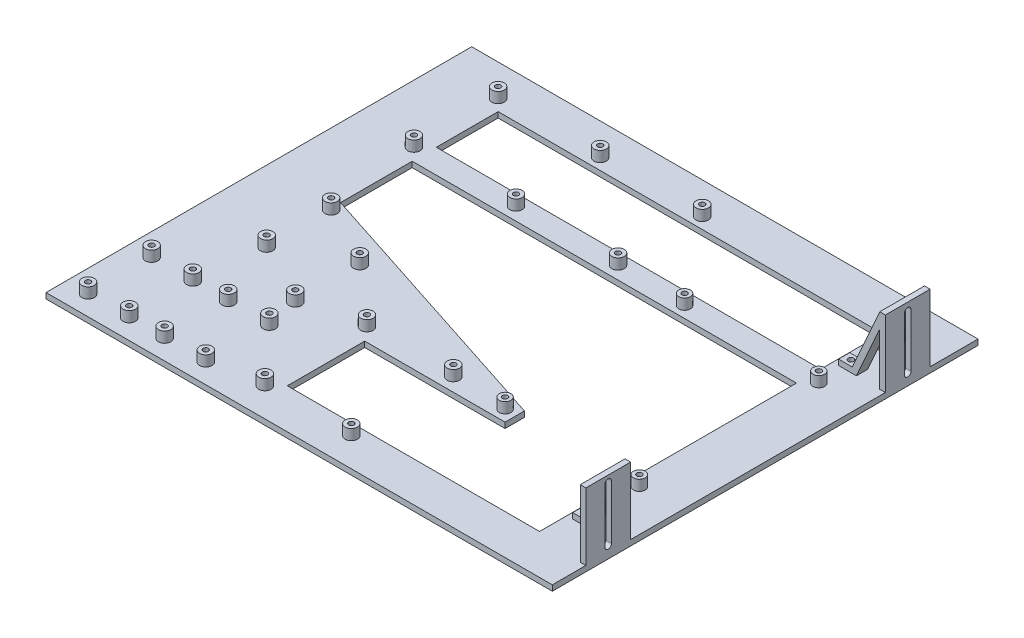
from build123d import *

# Parameters (mm, degrees)
SKETCH1_W            = 287.274
SKETCH1_H            = 241.554
BOSS_EXTRUDE1_DEPTH  = 3.175
SKETCH2_W            = 3.175
SKETCH2_H            = 25.4
BOSS_EXTRUDE3_DEPTH  = 38.1
CUT_EXTRUDE1_DEPTH   = 25.4
SKETCH4_R            = 3.302
SKETCH4_R_2          = 1.5
BOSS_EXTRUDE4_DEPTH  = 6
SKETCH5_R            = 3.5
SKETCH5_R_2          = 1.5
BOSS_EXTRUDE5_DEPTH  = 6
SKETCH6_R            = 3.5
SKETCH6_R_2          = 1.5
BOSS_EXTRUDE6_DEPTH  = 6
SKETCH7_R            = 3.5
SKETCH7_R_2          = 1.5
BOSS_EXTRUDE7_DEPTH  = 6
SKETCH8_R            = 3.5
SKETCH8_R_2          = 1.5
BOSS_EXTRUDE8_DEPTH  = 6
SKETCH9_W            = 3.175
SKETCH9_H            = 25.4
BOSS_EXTRUDE9_DEPTH  = 38.1
CUT_EXTRUDE3_DEPTH   = 38.1
BOSS_EXTRUDE11_DEPTH = 6.35
BOSS_EXTRUDE12_DEPTH = 6.35
BOSS_EXTRUDE13_DEPTH = 6.35
SKETCH25_W           = 3.771984775
SKETCH25_H           = 6.35
BOSS_EXTRUDE14_DEPTH = 3.175
SKETCH26_W           = 6.35
SKETCH26_H           = 3.175
BOSS_EXTRUDE15_DEPTH = 6.35
SKETCH27_R           = 1.5875
CUT_EXTRUDE7_DEPTH   = 3.175
SKETCH28_W           = 3.771984775
SKETCH28_H           = 6.35
BOSS_EXTRUDE16_DEPTH = 3.175
SKETCH29_W           = 6.35
SKETCH29_H           = 3.175
BOSS_EXTRUDE17_DEPTH = 6.35
SKETCH30_R           = 1.5875
CUT_EXTRUDE8_DEPTH   = 3.175
SKETCH31_W           = 3.771984775
SKETCH31_H           = 6.35
BOSS_EXTRUDE18_DEPTH = 3.175
SKETCH32_W           = 6.35
SKETCH32_H           = 3.175
BOSS_EXTRUDE19_DEPTH = 6.35
SKETCH33_R           = 1.5875
CUT_EXTRUDE9_DEPTH   = 3.175
SKETCH34_W           = 218.059
SKETCH34_H           = 35.052
CUT_EXTRUDE10_DEPTH  = 192.494860239


with BuildPart() as part:
    # Sketch1 → Boss-Extrude1 (new body)
    with BuildSketch(Plane(origin=(0, 0, 0), x_dir=(1, 0, 0), z_dir=(0, 1, 0))):
        Rectangle(SKETCH1_W, SKETCH1_H)
    extrude(amount=BOSS_EXTRUDE1_DEPTH)

    # Sketch2 → Boss-Extrude3 (add)
    with BuildSketch(Plane(origin=(0, 3.175, 0), x_dir=(1, 0, 0), z_dir=(0, 1, 0))):
        with Locations((142.0495, 80.899)):
            Rectangle(SKETCH2_W, SKETCH2_H)
    extrude(amount=BOSS_EXTRUDE3_DEPTH)

    # Sketch3 → Cut-Extrude1 (cut)
    with BuildSketch(Plane.ZY.offset(-140.462)):
        with BuildLine():
            Line((-78.994, 36.656885263), (-78.994, 6.383215744))
            ThreePointArc((-78.994, 6.383215744), (-80.899, 4.478215744), (-82.804, 6.383215744))
            Line((-82.804, 6.383215744), (-82.804, 36.656885263))
            ThreePointArc((-82.804, 36.656885263), (-80.899, 38.561885263), (-78.994, 36.656885263))
        make_face()
    extrude(amount=-CUT_EXTRUDE1_DEPTH, mode=Mode.SUBTRACT)

    # Sketch4 → Boss-Extrude4 (add)
    # profile 1 of 4: a face of its own
    with BuildSketch(Plane(origin=(0, 3.175, 0), x_dir=(1, 0, 0), z_dir=(0, 1, 0))):
        with Locations(Location((43.942, 53.975, 0), (0, 0, 270))):
            Circle(SKETCH4_R)
        with Locations(Location((43.942, 53.975, 0), (0, 0, 90))):
            Circle(SKETCH4_R_2, mode=Mode.SUBTRACT)
    # profile 2 of 4: a face of its own
    with BuildSketch(Plane(origin=(0, 3.175, 0), x_dir=(1, 0, 0), z_dir=(0, 1, 0))):
        with Locations(Location((120.142, 53.975, 0), (0, 0, 90))):
            Circle(SKETCH4_R)
        with Locations(Location((120.142, 53.975, 0), (0, 0, 270))):
            Circle(SKETCH4_R_2, mode=Mode.SUBTRACT)
    # profile 3 of 4: a face of its own
    with BuildSketch(Plane(origin=(0, 3.175, 0), x_dir=(1, 0, 0), z_dir=(0, 1, 0))):
        with Locations(Location((43.942, -47.879, 0), (0, 0, 90))):
            Circle(SKETCH4_R)
        with Locations(Location((43.942, -47.879, 0), (0, 0, 270))):
            Circle(SKETCH4_R_2, mode=Mode.SUBTRACT)
    # profile 4 of 4: a face of its own
    with BuildSketch(Plane(origin=(0, 3.175, 0), x_dir=(1, 0, 0), z_dir=(0, 1, 0))):
        with Locations(Location((120.142, -47.879, 0), (0, 0, 270))):
            Circle(SKETCH4_R)
        with Locations(Location((120.142, -47.879, 0), (0, 0, 90))):
            Circle(SKETCH4_R_2, mode=Mode.SUBTRACT)
    extrude(amount=BOSS_EXTRUDE4_DEPTH)

    # Sketch5 → Boss-Extrude5 (add)
    # profile 1 of 9: a face of its own
    with BuildSketch(Plane(origin=(0, 3.175, 0), x_dir=(1, 0, 0), z_dir=(0, 1, 0))):
        with Locations(Location((-110.617, 102.743, 0), (0, 0, 90))):
            Circle(SKETCH5_R)
        with Locations(Location((-110.617, 102.743, 0), (0, 0, 270))):
            Circle(SKETCH5_R_2, mode=Mode.SUBTRACT)
    # profile 2 of 9: a face of its own
    with BuildSketch(Plane(origin=(0, 3.175, 0), x_dir=(1, 0, 0), z_dir=(0, 1, 0))):
        with Locations(Location((-52.705, 102.743, 0), (0, 0, 90))):
            Circle(SKETCH5_R)
        with Locations(Location((-52.705, 102.743, 0), (0, 0, 270))):
            Circle(SKETCH5_R_2, mode=Mode.SUBTRACT)
    # profile 3 of 9: a face of its own
    with BuildSketch(Plane(origin=(0, 3.175, 0), x_dir=(1, 0, 0), z_dir=(0, 1, 0))):
        with BuildLine():
            ThreePointArc((8.707, 102.743), (8.686399881, 103.122178676), (8.624842018, 103.496893852))
            Line((8.624842018, 103.496893852), (6.503782194, 103.496893852))
            ThreePointArc((6.503782194, 103.496893852), (6.655304749, 103.13340153), (6.707, 102.743))
            ThreePointArc((6.707, 102.743), (4.146339828, 101.682339828), (5.207, 104.243))
            Line((5.207, 104.243), (5.207, 106.243))
            ThreePointArc((5.207, 106.243), (2.732126266, 100.268126266), (8.707, 102.743))
        make_face()
    # profile 4 of 9: a face of its own
    with BuildSketch(Plane(origin=(0, 3.175, 0), x_dir=(1, 0, 0), z_dir=(0, 1, 0))):
        with BuildLine():
            Line((6.503782194, 103.496893852), (8.624842018, 103.496893852))
            ThreePointArc((8.624842018, 103.496893852), (7.399187437, 105.471427064), (5.207, 106.243))
            Line((5.207, 106.243), (5.207, 104.243))
            ThreePointArc((5.207, 104.243), (5.95505054, 104.043161678), (6.503782194, 103.496893852))
        make_face()
    # profile 5 of 9: a face of its own
    with BuildSketch(Plane(origin=(0, 3.175, 0), x_dir=(1, 0, 0), z_dir=(0, 1, 0))):
        with BuildLine():
            ThreePointArc((8.707, 102.743), (8.686399881, 103.122178676), (8.624842018, 103.496893852))
            Line((8.624842018, 103.496893852), (6.503782194, 103.496893852))
            ThreePointArc((6.503782194, 103.496893852), (6.655304749, 103.13340153), (6.707, 102.743))
            ThreePointArc((6.707, 102.743), (4.146339828, 101.682339828), (5.207, 104.243))
            Line((5.207, 104.243), (5.207, 106.243))
            ThreePointArc((5.207, 106.243), (2.732126266, 100.268126266), (8.707, 102.743))
        make_face()
    # profile 6 of 9: a face of its own
    with BuildSketch(Plane(origin=(0, 3.175, 0), x_dir=(1, 0, 0), z_dir=(0, 1, 0))):
        with BuildLine():
            Line((6.503782194, 103.496893852), (8.624842018, 103.496893852))
            ThreePointArc((8.624842018, 103.496893852), (7.399187437, 105.471427064), (5.207, 106.243))
            Line((5.207, 106.243), (5.207, 104.243))
            ThreePointArc((5.207, 104.243), (5.95505054, 104.043161678), (6.503782194, 103.496893852))
        make_face()
    # profile 7 of 9: a face of its own
    with BuildSketch(Plane(origin=(0, 3.175, 0), x_dir=(1, 0, 0), z_dir=(0, 1, 0))):
        with Locations(Location((-110.617, 54.991, 0), (0, 0, 90))):
            Circle(SKETCH5_R)
        with Locations(Location((-110.617, 54.991, 0), (0, 0, 270))):
            Circle(SKETCH5_R_2, mode=Mode.SUBTRACT)
    # profile 8 of 9: a face of its own
    with BuildSketch(Plane(origin=(0, 3.175, 0), x_dir=(1, 0, 0), z_dir=(0, 1, 0))):
        with Locations(Location((-52.705, 54.991, 0), (0, 0, 90))):
            Circle(SKETCH5_R)
        with Locations(Location((-52.705, 54.991, 0), (0, 0, 270))):
            Circle(SKETCH5_R_2, mode=Mode.SUBTRACT)
    # profile 9 of 9: a face of its own
    with BuildSketch(Plane(origin=(0, 3.175, 0), x_dir=(1, 0, 0), z_dir=(0, 1, 0))):
        with Locations(Location((5.207, 54.991, 0), (0, 0, 90))):
            Circle(SKETCH5_R)
        with Locations(Location((5.207, 54.991, 0), (0, 0, 270))):
            Circle(SKETCH5_R_2, mode=Mode.SUBTRACT)
    extrude(amount=BOSS_EXTRUDE5_DEPTH)

    # Sketch6 → Boss-Extrude6 (add)
    # profile 1 of 8: a face of its own
    with BuildSketch(Plane(origin=(0, 3.175, 0), x_dir=(1, 0, 0), z_dir=(0, 1, 0))):
        with Locations(Location((-130.937, -73.533, 0), (0, 0, 90))):
            Circle(SKETCH6_R)
        with Locations(Location((-130.937, -73.533, 0), (0, 0, 270))):
            Circle(SKETCH6_R_2, mode=Mode.SUBTRACT)
    # profile 2 of 8: a face of its own
    with BuildSketch(Plane(origin=(0, 3.175, 0), x_dir=(1, 0, 0), z_dir=(0, 1, 0))):
        with Locations(Location((-107.569, -73.533, 0), (0, 0, 90))):
            Circle(SKETCH6_R)
        with Locations(Location((-107.569, -73.533, 0), (0, 0, 270))):
            Circle(SKETCH6_R_2, mode=Mode.SUBTRACT)
    # profile 3 of 8: a face of its own
    with BuildSketch(Plane(origin=(0, 3.175, 0), x_dir=(1, 0, 0), z_dir=(0, 1, 0))):
        with Locations(Location((-130.937, -109.601, 0), (0, 0, 90))):
            Circle(SKETCH6_R)
        with Locations(Location((-130.937, -109.601, 0), (0, 0, 270))):
            Circle(SKETCH6_R_2, mode=Mode.SUBTRACT)
    # profile 4 of 8: a face of its own
    with BuildSketch(Plane(origin=(0, 3.175, 0), x_dir=(1, 0, 0), z_dir=(0, 1, 0))):
        with Locations(Location((-107.569, -109.601, 0), (0, 0, 90))):
            Circle(SKETCH6_R)
        with Locations(Location((-107.569, -109.601, 0), (0, 0, 270))):
            Circle(SKETCH6_R_2, mode=Mode.SUBTRACT)
    # profile 5 of 8: a face of its own
    with BuildSketch(Plane(origin=(0, 3.175, 0), x_dir=(1, 0, 0), z_dir=(0, 1, 0))):
        with Locations(Location((-87.503, -73.533, 0), (0, 0, 90))):
            Circle(SKETCH6_R)
        with Locations(Location((-87.503, -73.533, 0), (0, 0, 270))):
            Circle(SKETCH6_R_2, mode=Mode.SUBTRACT)
    # profile 6 of 8: a face of its own
    with BuildSketch(Plane(origin=(0, 3.175, 0), x_dir=(1, 0, 0), z_dir=(0, 1, 0))):
        with Locations(Location((-64.135, -73.533, 0), (0, 0, 90))):
            Circle(SKETCH6_R)
        with Locations(Location((-64.135, -73.533, 0), (0, 0, 270))):
            Circle(SKETCH6_R_2, mode=Mode.SUBTRACT)
    # profile 7 of 8: a face of its own
    with BuildSketch(Plane(origin=(0, 3.175, 0), x_dir=(1, 0, 0), z_dir=(0, 1, 0))):
        with Locations(Location((-87.503, -109.601, 0), (0, 0, 90))):
            Circle(SKETCH6_R)
        with Locations(Location((-87.503, -109.601, 0), (0, 0, 270))):
            Circle(SKETCH6_R_2, mode=Mode.SUBTRACT)
    # profile 8 of 8: a face of its own
    with BuildSketch(Plane(origin=(0, 3.175, 0), x_dir=(1, 0, 0), z_dir=(0, 1, 0))):
        with Locations(Location((-64.135, -109.601, 0), (0, 0, 90))):
            Circle(SKETCH6_R)
        with Locations(Location((-64.135, -109.601, 0), (0, 0, 270))):
            Circle(SKETCH6_R_2, mode=Mode.SUBTRACT)
    extrude(amount=BOSS_EXTRUDE6_DEPTH)

    # Sketch7 → Boss-Extrude7 (add)
    # profile 1 of 4: a face of its own
    with BuildSketch(Plane(origin=(0, 3.175, 0), x_dir=(1, 0, 0), z_dir=(0, 1, 0))):
        with Locations(Location((-103.251, -35.941, 0), (0, 0, 90))):
            Circle(SKETCH7_R)
        with Locations(Location((-103.251, -35.941, 0), (0, 0, 270))):
            Circle(SKETCH7_R_2, mode=Mode.SUBTRACT)
    # profile 2 of 4: a face of its own
    with BuildSketch(Plane(origin=(0, 3.175, 0), x_dir=(1, 0, 0), z_dir=(0, 1, 0))):
        with Locations(Location((-68.199, -54.737, 0), (0, 0, 90))):
            Circle(SKETCH7_R)
        with Locations(Location((-68.199, -54.737, 0), (0, 0, 270))):
            Circle(SKETCH7_R_2, mode=Mode.SUBTRACT)
    # profile 3 of 4: a face of its own
    with BuildSketch(Plane(origin=(0, 3.175, 0), x_dir=(1, 0, 0), z_dir=(0, 1, 0))):
        with Locations(Location((-103.251, 0.635, 0), (0, 0, 90))):
            Circle(SKETCH7_R)
        with Locations(Location((-103.251, 0.635, 0), (0, 0, 270))):
            Circle(SKETCH7_R_2, mode=Mode.SUBTRACT)
    # profile 4 of 4: a face of its own
    with BuildSketch(Plane(origin=(0, 3.175, 0), x_dir=(1, 0, 0), z_dir=(0, 1, 0))):
        with Locations(Location((-68.199, -18.161, 0), (0, 0, 90))):
            Circle(SKETCH7_R)
        with Locations(Location((-68.199, -18.161, 0), (0, 0, 270))):
            Circle(SKETCH7_R_2, mode=Mode.SUBTRACT)
    extrude(amount=BOSS_EXTRUDE7_DEPTH)

    # Sketch8 → Boss-Extrude8 (add)
    # profile 1 of 4: a face of its own
    with BuildSketch(Plane(origin=(0, 3.175, 0), x_dir=(1, 0, 0), z_dir=(0, 1, 0))):
        with Locations(Location((-35.687, -46.609, 0), (0, 0, 90))):
            Circle(SKETCH8_R)
        with Locations(Location((-35.687, -46.609, 0), (0, 0, 270))):
            Circle(SKETCH8_R_2, mode=Mode.SUBTRACT)
    # profile 2 of 4: a face of its own
    with BuildSketch(Plane(origin=(0, 3.175, 0), x_dir=(1, 0, 0), z_dir=(0, 1, 0))):
        with Locations(Location((13.335, -46.609, 0), (0, 0, 90))):
            Circle(SKETCH8_R)
        with Locations(Location((13.335, -46.609, 0), (0, 0, 270))):
            Circle(SKETCH8_R_2, mode=Mode.SUBTRACT)
    # profile 3 of 4: a face of its own
    with BuildSketch(Plane(origin=(0, 3.175, 0), x_dir=(1, 0, 0), z_dir=(0, 1, 0))):
        with Locations(Location((-35.687, -104.521, 0), (0, 0, 90))):
            Circle(SKETCH8_R)
        with Locations(Location((-35.687, -104.521, 0), (0, 0, 270))):
            Circle(SKETCH8_R_2, mode=Mode.SUBTRACT)
    # profile 4 of 4: a face of its own
    with BuildSketch(Plane(origin=(0, 3.175, 0), x_dir=(1, 0, 0), z_dir=(0, 1, 0))):
        with Locations(Location((13.335, -104.521, 0), (0, 0, 90))):
            Circle(SKETCH8_R)
        with Locations(Location((13.335, -104.521, 0), (0, 0, 270))):
            Circle(SKETCH8_R_2, mode=Mode.SUBTRACT)
    extrude(amount=BOSS_EXTRUDE8_DEPTH)

    # Sketch9 → Boss-Extrude9 (add)
    with BuildSketch(Plane(origin=(0, 3.175, 0), x_dir=(1, 0, 0), z_dir=(0, 1, 0))):
        with Locations((142.0495, -89.027)):
            Rectangle(SKETCH9_W, SKETCH9_H)
    extrude(amount=BOSS_EXTRUDE9_DEPTH)

    # Sketch13 → Cut-Extrude3 (cut)
    with BuildSketch(Plane.ZY.offset(-140.462)):
        with BuildLine():
            Line((90.975914262, 37.446352615), (90.975914262, 6.709880429))
            ThreePointArc((90.975914262, 6.709880429), (89.070914262, 4.804880429), (87.165914262, 6.709880429))
            Line((87.165914262, 6.709880429), (87.165914262, 37.446352615))
            ThreePointArc((87.165914262, 37.446352615), (89.070914262, 39.351352615), (90.975914262, 37.446352615))
        make_face()
    extrude(amount=-CUT_EXTRUDE3_DEPTH, mode=Mode.SUBTRACT)

    # Sketch17 → Boss-Extrude11 (add)
    with BuildSketch(Plane(origin=(0, 0, -93.599), x_dir=(-1, 0, 0), z_dir=(0, 0, -1))):
        Polygon((-140.462, 41.275), (-123.444, 3.175), (-127.215984775, 3.175), (-140.462, 32.830257966), align=None)
    extrude(amount=-BOSS_EXTRUDE11_DEPTH)

    # Sketch22 → Boss-Extrude12 (add)
    with BuildSketch(Plane(origin=(0, 0, 76.327), x_dir=(-1, 0, 0), z_dir=(0, 0, -1))):
        Polygon((-140.462, 41.275), (-123.444, 3.175), (-127.215984775, 3.175), (-140.462, 32.830257966), align=None)
    extrude(amount=-BOSS_EXTRUDE12_DEPTH)

    # Sketch23 → Boss-Extrude13 (add)
    with BuildSketch(Plane.XY.offset(-68.199)):
        Polygon((140.462, 41.275), (123.444, 3.175), (127.215984775, 3.175), (140.462, 32.830257966), align=None)
    extrude(amount=-BOSS_EXTRUDE13_DEPTH)

    # Sketch25 → Boss-Extrude14 (add)
    with BuildSketch(Plane(origin=(0, 3.175, 0), x_dir=(1, 0, 0), z_dir=(0, 1, 0))):
        with Locations((125.329992387, 90.424)):
            Rectangle(SKETCH25_W, SKETCH25_H)
    extrude(amount=BOSS_EXTRUDE14_DEPTH)

    # Sketch26 → Boss-Extrude15 (add)
    with BuildSketch(Plane.ZY.offset(-123.444)):
        with Locations((-90.424, 4.7625)):
            Rectangle(SKETCH26_W, SKETCH26_H)
    extrude(amount=BOSS_EXTRUDE15_DEPTH)

    # Sketch27 → Cut-Extrude7 (cut)
    with BuildSketch(Plane(origin=(0, 6.35, 0), x_dir=(1, 0, 0), z_dir=(0, 1, 0))):
        with Locations(Location((120.978083333, 90.424, 0), (0, 0, 270))):
            Circle(SKETCH27_R)
    extrude(amount=-CUT_EXTRUDE7_DEPTH, mode=Mode.SUBTRACT)

    # Sketch28 → Boss-Extrude16 (add)
    with BuildSketch(Plane(origin=(0, 3.175, 0), x_dir=(1, 0, 0), z_dir=(0, 1, 0))):
        with Locations((125.329992387, 71.374)):
            Rectangle(SKETCH28_W, SKETCH28_H)
    extrude(amount=BOSS_EXTRUDE16_DEPTH)

    # Sketch29 → Boss-Extrude17 (add)
    with BuildSketch(Plane.ZY.offset(-123.444)):
        with Locations((-71.374, 4.7625)):
            Rectangle(SKETCH29_W, SKETCH29_H)
    extrude(amount=BOSS_EXTRUDE17_DEPTH)

    # Sketch30 → Cut-Extrude8 (cut)
    with BuildSketch(Plane(origin=(0, 6.35, 0), x_dir=(1, 0, 0), z_dir=(0, 1, 0))):
        with Locations(Location((120.978083333, 71.374, 0), (0, 0, 270))):
            Circle(SKETCH30_R)
    extrude(amount=-CUT_EXTRUDE8_DEPTH, mode=Mode.SUBTRACT)

    # Sketch31 → Boss-Extrude18 (add)
    with BuildSketch(Plane(origin=(0, 3.175, 0), x_dir=(1, 0, 0), z_dir=(0, 1, 0))):
        with Locations((125.329992387, -79.502)):
            Rectangle(SKETCH31_W, SKETCH31_H)
    extrude(amount=BOSS_EXTRUDE18_DEPTH)

    # Sketch32 → Boss-Extrude19 (add)
    with BuildSketch(Plane.ZY.offset(-123.444)):
        with Locations((79.502, 4.7625)):
            Rectangle(SKETCH32_W, SKETCH32_H)
    extrude(amount=BOSS_EXTRUDE19_DEPTH)

    # Sketch33 → Cut-Extrude9 (cut)
    with BuildSketch(Plane(origin=(0, 6.35, 0), x_dir=(1, 0, 0), z_dir=(0, 1, 0))):
        with Locations(Location((120.978083333, -79.502, 0), (0, 0, 270))):
            Circle(SKETCH33_R)
    extrude(amount=-CUT_EXTRUDE9_DEPTH, mode=Mode.SUBTRACT)

    # Sketch34 → Cut-Extrude10 (cut, through all)
    with BuildSketch(Plane(origin=(0, 3.175, 0), x_dir=(1, 0, 0), z_dir=(0, 1, 0))):
        with Locations((4.7625, 78.867)):
            Rectangle(SKETCH34_W, SKETCH34_H)
        Polygon((-104.267, 47.625), (113.792, 47.625), (113.792, 6.985), (113.792, -54.229), (113.792, -98.171), (-29.337, -98.171), (-29.337, -54.229), (50.292, -54.229), (50.292, -43.230804088), (-104.267, 6.985), align=None)
    extrude(amount=-CUT_EXTRUDE10_DEPTH, mode=Mode.SUBTRACT)


solid = part.part
